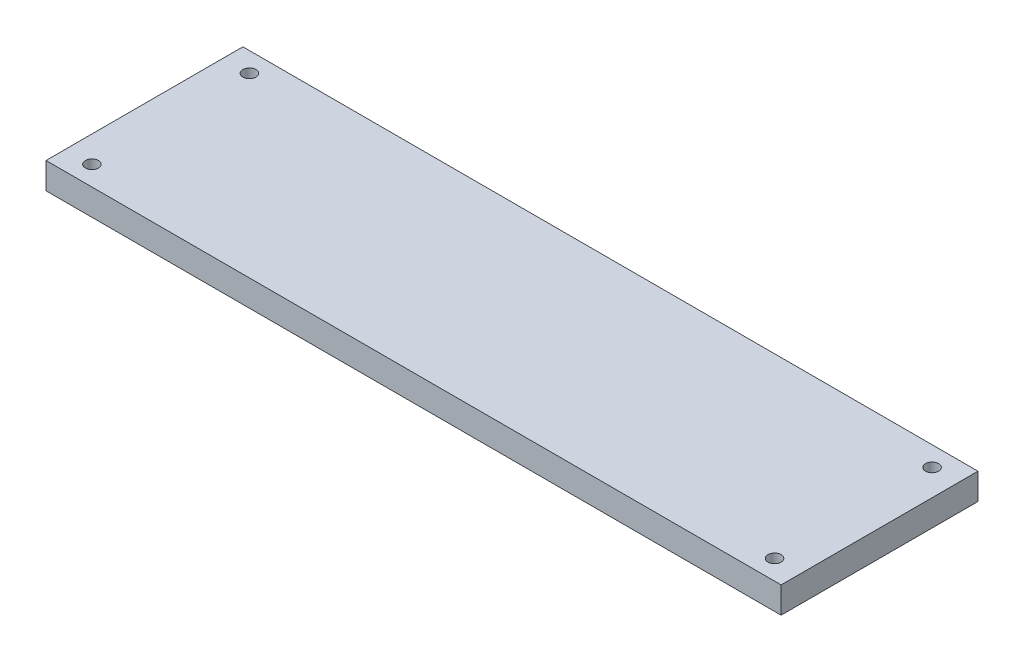
from build123d import *

# Parameters (mm, degrees)
SKETCH1_W           = 355.6
SKETCH1_H           = 95.25
BOSS_EXTRUDE1_DEPTH = 12.7
SKETCH2_R           = 3.175
CUT_EXTRUDE1_DEPTH  = 185.505475867


with BuildPart() as part:
    # Sketch1 → Boss-Extrude1 (new body)
    with BuildSketch(Plane(origin=(0, 0, 0), x_dir=(1, 0, 0), z_dir=(0, 1, 0))):
        Rectangle(SKETCH1_W, SKETCH1_H)
    extrude(amount=BOSS_EXTRUDE1_DEPTH)

    # Sketch2 → Cut-Extrude1 (cut, through all)
    with BuildSketch(Plane(origin=(0, 12.7, 0), x_dir=(1, 0, 0), z_dir=(0, 1, 0))):
        with Locations(Location((165.1, 38.1, 0), (0, 0, 270))):
            Circle(SKETCH2_R)
        with Locations(Location((-165.1, 38.1, 0), (0, 0, 90))):
            Circle(SKETCH2_R)
        with Locations(Location((165.1, -38.1, 0), (0, 0, 90))):
            Circle(SKETCH2_R)
        with Locations(Location((-165.1, -38.1, 0), (0, 0, 270))):
            Circle(SKETCH2_R)
    extrude(amount=-CUT_EXTRUDE1_DEPTH, mode=Mode.SUBTRACT)


solid = part.part
